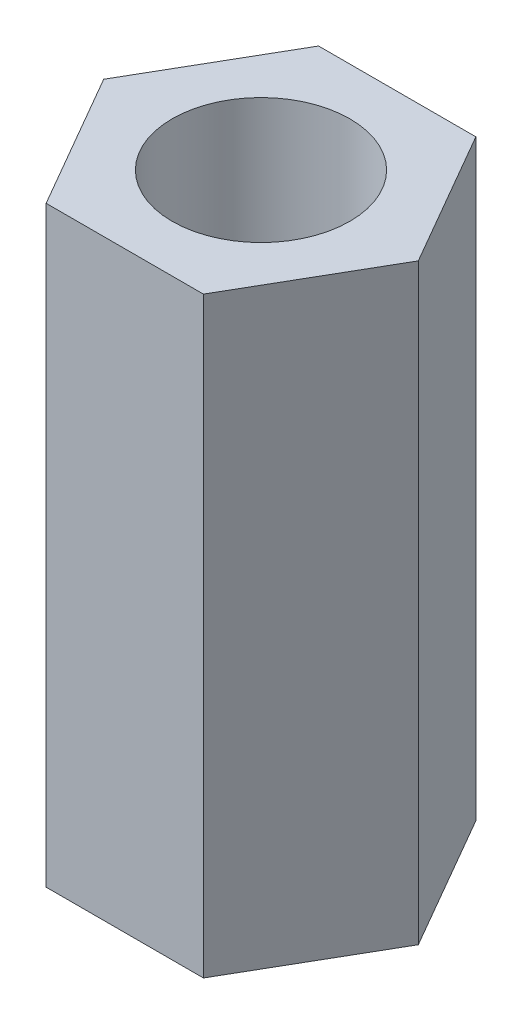
from build123d import *

# Parameters (mm, degrees)
SKETCH_1_R      = 1.5
EXTRUDE_1_DEPTH = 10


with BuildPart() as part:
    # 草图1 → 凸台-拉伸1 (new body)
    with BuildSketch(Plane(origin=(0, 0, 0), x_dir=(1, 0, 0), z_dir=(0, 1, 0))):
        Polygon((1.327905619, -2.3), (2.655811238, 0), (1.327905619, 2.3), (-1.327905619, 2.3), (-2.655811238, 0), (-1.327905619, -2.3), align=None)
        with Locations(Location((0, 0, 0), (0, 0, 270))):
            Circle(SKETCH_1_R, mode=Mode.SUBTRACT)
    extrude(amount=EXTRUDE_1_DEPTH)


solid = part.part
